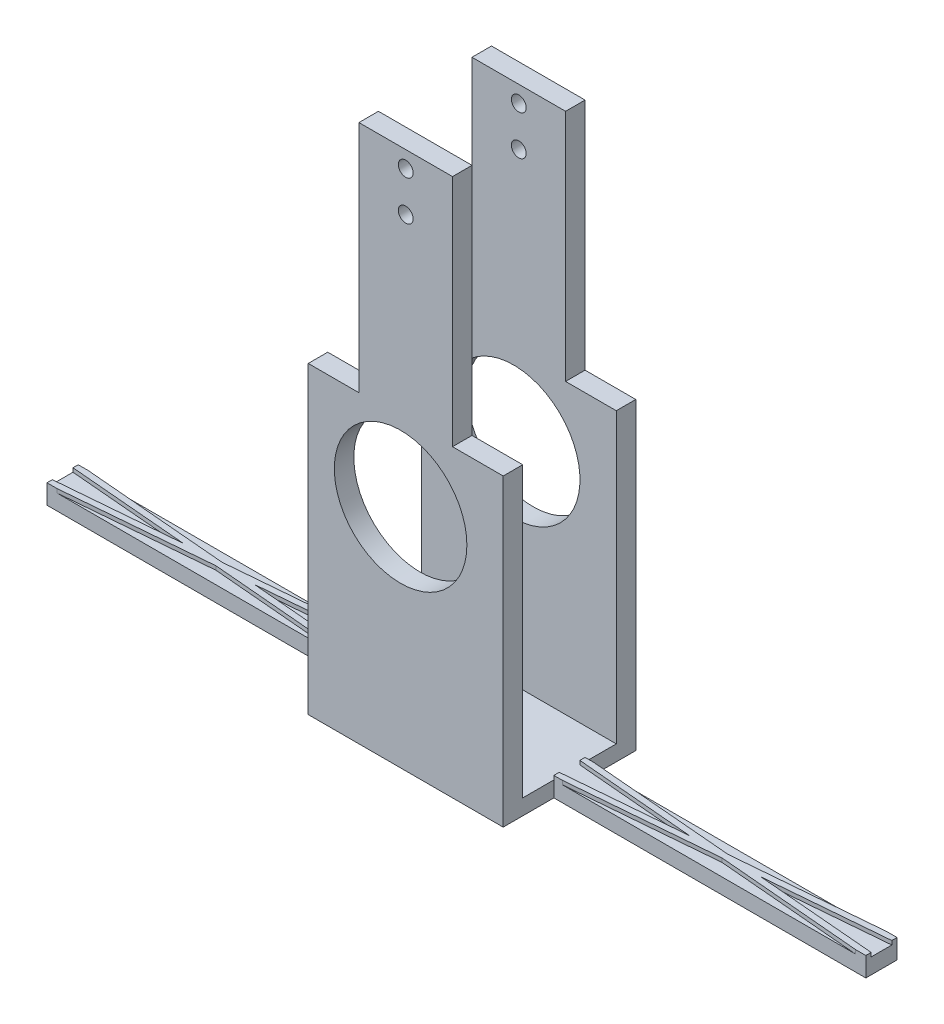
from build123d import *

# Parameters (mm, degrees)
SKETCH1_W           = 40
SKETCH1_H           = 4
SKETCH1_W_2         = 25
SKETCH1_H_2         = 17
BOSS_EXTRUDE1_DEPTH = 2
BOSS_EXTRUDE2_DEPTH = 0.5
SKETCH3_W           = 25
SKETCH3_H           = 2.5
BOSS_EXTRUDE3_DEPTH = 37
SKETCH4_R           = 8.5
CUT_EXTRUDE1_DEPTH  = 37
SKETCH6_W           = 12
SKETCH6_H           = 2.5
BOSS_EXTRUDE4_DEPTH = 30
SKETCH8_R           = 0.95
CUT_EXTRUDE2_DEPTH  = 30


with BuildPart() as part:
    # Sketch1 → Boss-Extrude1 (new body)
    with BuildSketch(Plane(origin=(0, 0, 0), x_dir=(1, 0, 0), z_dir=(0, 1, 0))):
        with Locations((-57.947101463, -109.729781289)):
            Rectangle(SKETCH1_W, SKETCH1_H)
        with Locations((-25.447101463, -109.729781289)):
            Rectangle(SKETCH1_W_2, SKETCH1_H_2)
        with Locations((7.052898537, -109.729781289)):
            Rectangle(SKETCH1_W, SKETCH1_H)
    extrude(amount=BOSS_EXTRUDE1_DEPTH)

    # Sketch2 → Boss-Extrude2 (add)
    with BuildSketch(Plane(origin=(0, 2, 0), x_dir=(1, 0, 0), z_dir=(0, 1, 0))):
        Polygon((-77.947101463, -108.397425258), (-62.457280687, -109.724520363), (-57.894492201, -109.335653269), (-76.638189664, -107.729781289), (-77.947101463, -107.729781289), align=None)
        Polygon((-76.638189664, -111.729781289), (-57.894492201, -110.115438654), (-62.457280687, -109.724520363), (-77.947101463, -111.044652036), (-77.947101463, -111.729781289), align=None)
        Polygon((-57.894492201, -110.115438654), (-39.051925459, -111.729781289), (-37.947101463, -111.729781289), (-37.947101463, -111.044652036), (-53.355645232, -109.724520363), align=None)
        Polygon((-62.457280687, -109.724520363), (-57.894492201, -110.115438654), (-53.355645232, -109.724520363), (-57.894492201, -109.335653269), align=None)
        Polygon((-57.894492201, -109.335653269), (-53.355645232, -109.724520363), (-37.947101463, -108.397425258), (-37.947101463, -107.729781289), (-39.051925459, -107.729781289), align=None)
        Polygon((-11.842277467, -111.729781289), (7.000289276, -110.115438654), (2.461442306, -109.724520363), (-12.947101463, -111.044652036), (-12.947101463, -111.729781289), align=None)
        Polygon((2.461442306, -109.724520363), (7.000289276, -109.335653269), (-11.842277467, -107.729781289), (-12.947101463, -107.729781289), (-12.947101463, -108.397425258), align=None)
        Polygon((7.000289276, -110.115438654), (11.563077761, -109.724520363), (7.000289276, -109.335653269), (2.461442306, -109.724520363), align=None)
        Polygon((27.052898537, -111.729781289), (27.052898537, -111.044652036), (11.563077761, -109.724520363), (7.000289276, -110.115438654), (25.743986738, -111.729781289), align=None)
        Polygon((7.000289276, -109.335653269), (11.563077761, -109.724520363), (27.052898537, -108.397425258), (27.052898537, -107.729781289), (25.743986738, -107.729781289), align=None)
    extrude(amount=BOSS_EXTRUDE2_DEPTH)

    # Sketch3 → Boss-Extrude3 (add)
    with BuildSketch(Plane(origin=(0, 2, 0), x_dir=(1, 0, 0), z_dir=(0, 1, 0))):
        with Locations((-25.447101463, -116.979781289)):
            Rectangle(SKETCH3_W, SKETCH3_H)
        with Locations((-25.447101463, -102.479781289)):
            Rectangle(SKETCH3_W, SKETCH3_H)
    extrude(amount=BOSS_EXTRUDE3_DEPTH)

    # Sketch4 → Cut-Extrude1 (cut)
    with BuildSketch(Plane.XY.offset(118.229781289)):
        with Locations(Location((-26.102234561, 29, 0), (0, 0, 180))):
            Circle(SKETCH4_R)
    extrude(amount=-CUT_EXTRUDE1_DEPTH, mode=Mode.SUBTRACT)

    # Sketch6 → Boss-Extrude4 (add)
    with BuildSketch(Plane(origin=(0, 39, 0), x_dir=(1, 0, 0), z_dir=(0, 1, 0))):
        with Locations((-25.447101463, -116.979781289)):
            Rectangle(SKETCH6_W, SKETCH6_H)
        with Locations((-25.447101463, -102.479781289)):
            Rectangle(SKETCH6_W, SKETCH6_H)
    extrude(amount=BOSS_EXTRUDE4_DEPTH)

    # Sketch8 → Cut-Extrude2 (cut)
    with BuildSketch(Plane.XY.offset(118.229781289)):
        with Locations(Location((-25.447101463, 66.872747416, 0), (0, 0, 180))):
            Circle(SKETCH8_R)
        with Locations(Location((-25.447101463, 61.774545812, 0), (0, 0, 180))):
            Circle(SKETCH8_R)
    extrude(amount=-CUT_EXTRUDE2_DEPTH, mode=Mode.SUBTRACT)


solid = part.part
